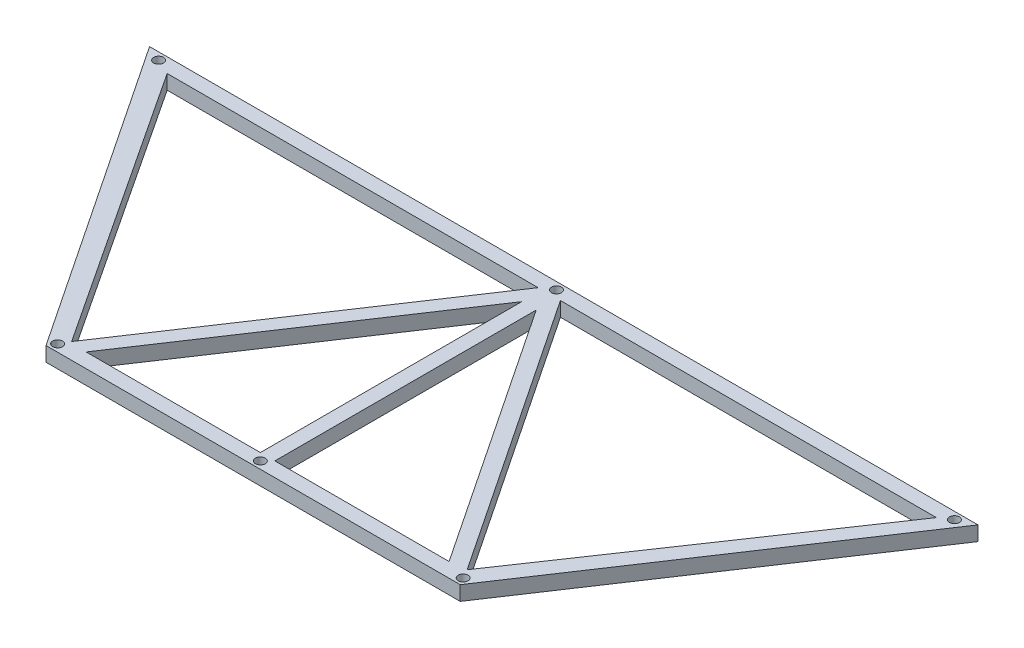
from build123d import *

# Parameters (mm, degrees)
SKETCH1_R           = 4.7625
BOSS_EXTRUDE2_DEPTH = 14


with BuildPart() as part:
    # Sketch1 → Boss-Extrude2 (new body)
    with BuildSketch(Plane(origin=(0, 0, 0), x_dir=(1, 0, 0), z_dir=(0, 1, 0))):
        Polygon((0, 300), (400, 300), (200, 0), (0, 0), (-200, 0), (-400, 300), align=None)
        with Locations(Location((0, 293, 0), (0, 0, 270))):
            Circle(SKETCH1_R, mode=Mode.SUBTRACT)
        with Locations(Location((0, 7, 0), (0, 0, 270))):
            Circle(SKETCH1_R, mode=Mode.SUBTRACT)
        with Locations(Location((384.258956968, 293, 0), (0, 0, 270))):
            Circle(SKETCH1_R, mode=Mode.SUBTRACT)
        with Locations(Location((-384.258956968, 293, 0), (0, 0, 90))):
            Circle(SKETCH1_R, mode=Mode.SUBTRACT)
        with Locations(Location((-195.793523512, 7, 0), (0, 0, 270))):
            Circle(SKETCH1_R, mode=Mode.SUBTRACT)
        with Locations(Location((195.793523512, 7, 0), (0, 0, 90))):
            Circle(SKETCH1_R, mode=Mode.SUBTRACT)
        Polygon((7, 14), (7, 266.380570536), (175.253713691, 14), align=None, mode=Mode.SUBTRACT)
        Polygon((10.746286309, 286), (373.840760715, 286), (190.836035912, 15.865375596), align=None, mode=Mode.SUBTRACT)
        Polygon((-190.947369666, 15.698374965), (-10.746286309, 286), (-368.994606868, 286), align=None, mode=Mode.SUBTRACT)
        Polygon((-175.253713691, 14), (-7, 266.380570536), (-7, 14), align=None, mode=Mode.SUBTRACT)
    extrude(amount=BOSS_EXTRUDE2_DEPTH)


solid = part.part
